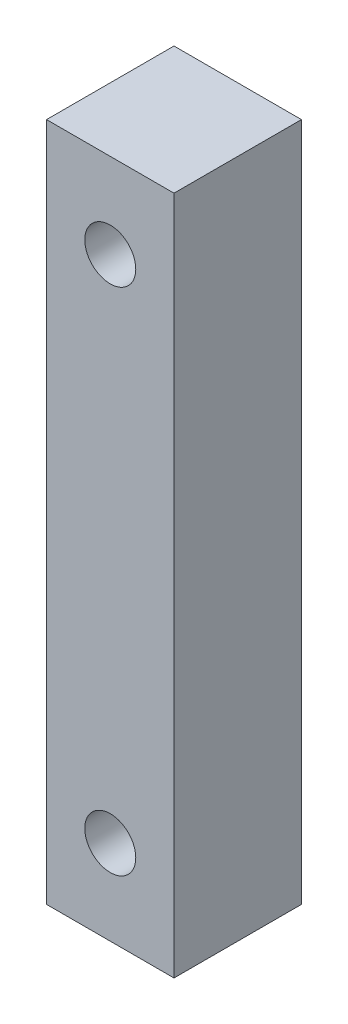
from build123d import *

# Parameters (mm, degrees)
SKETCH_1_W          = 15
SKETCH_1_H          = 15
EXTRUDE_1_DEPTH     = 80
SKETCH_2_R          = 3
CUT_EXTRUDE_1_DEPTH = 83.764726786


with BuildPart() as part:
    # 草图1 → 凸台-拉伸1 (new body)
    with BuildSketch(Plane(origin=(0, 0, 0), x_dir=(1, 0, 0), z_dir=(0, 1, 0))):
        with Locations((7.5, -7.5)):
            Rectangle(SKETCH_1_W, SKETCH_1_H)
    extrude(amount=EXTRUDE_1_DEPTH)

    # 草图2 → 切除-拉伸1 (cut, through all)
    with BuildSketch(Plane.XY.offset(15)):
        with Locations((7.5, 70)):
            Circle(SKETCH_2_R)
        with Locations((7.5, 10)):
            Circle(SKETCH_2_R)
    extrude(amount=-CUT_EXTRUDE_1_DEPTH, mode=Mode.SUBTRACT)


solid = part.part
